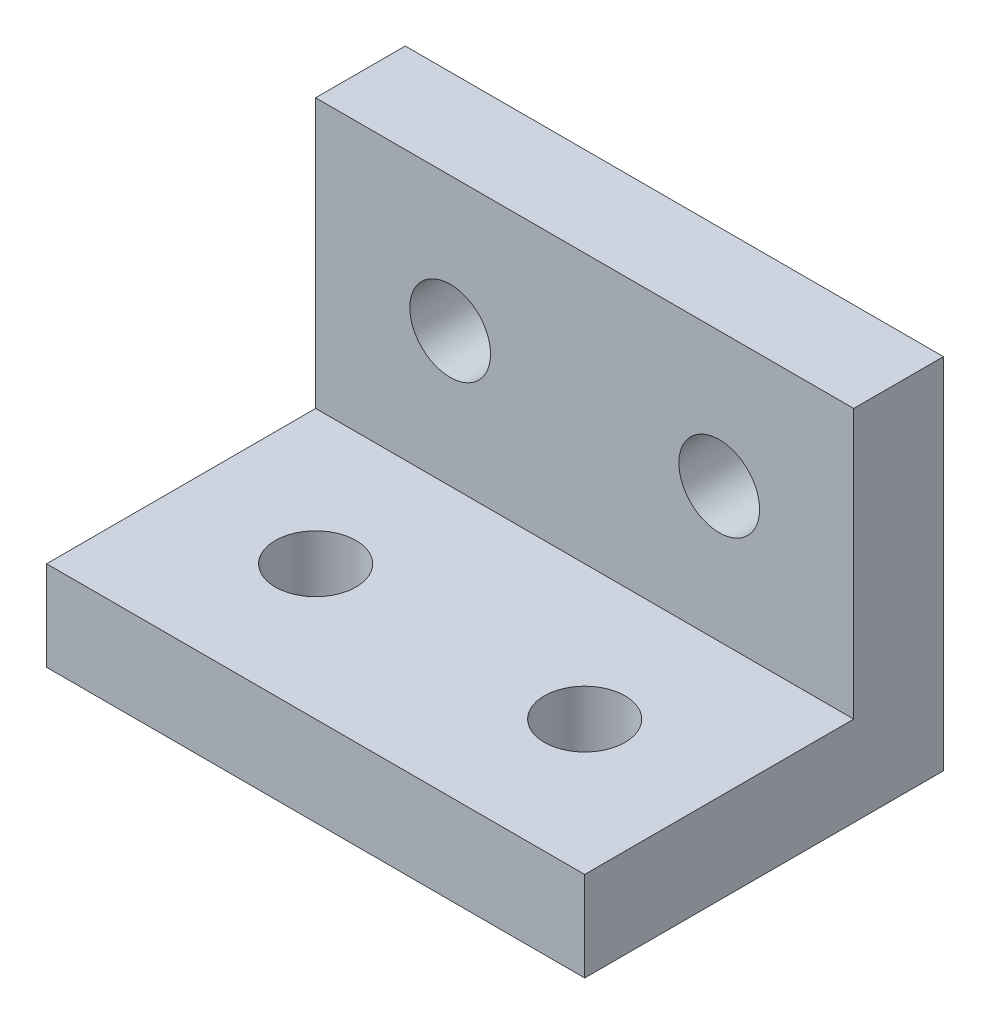
from build123d import *

# Parameters (mm, degrees)
BOSS_EXTRUDE1_DEPTH = 30
SKETCH2_R           = 2.25
CUT_EXTRUDE1_DEPTH  = 40.05124838
SKETCH3_R           = 2.25
CUT_EXTRUDE2_DEPTH  = 40.05124838


with BuildPart() as part:
    # Sketch1 → Boss-Extrude1 (new body)
    with BuildSketch(Plane(origin=(0, 0, 0), x_dir=(0, 0, -1), z_dir=(1, 0, 0))):
        Polygon((0, 0), (0, 20), (-5, 20), (-5, 5), (-20, 5), (-20, 0), align=None)
    extrude(amount=BOSS_EXTRUDE1_DEPTH)

    # Sketch2 → Cut-Extrude1 (cut, through all)
    with BuildSketch(Plane.XY.offset(5)):
        with Locations((7.5, 12.5)):
            Circle(SKETCH2_R)
        with Locations((22.5, 12.5)):
            Circle(SKETCH2_R)
    extrude(amount=-CUT_EXTRUDE1_DEPTH, mode=Mode.SUBTRACT)

    # Sketch3 → Cut-Extrude2 (cut, through all)
    with BuildSketch(Plane(origin=(0, 5, 0), x_dir=(1, 0, 0), z_dir=(0, 1, 0))):
        with Locations(Location((7.5, -12.5, 0), (0, 0, 270))):
            Circle(SKETCH3_R)
        with Locations(Location((22.5, -12.5, 0), (0, 0, 270))):
            Circle(SKETCH3_R)
    extrude(amount=-CUT_EXTRUDE2_DEPTH, mode=Mode.SUBTRACT)


solid = part.part
